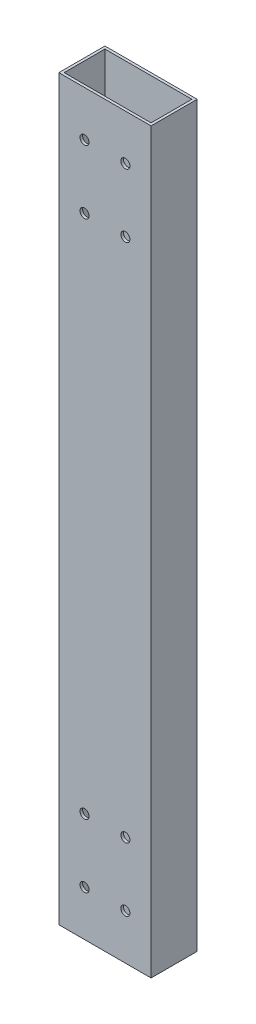
from build123d import *

# Parameters (mm, degrees)
SKETCH1_W           = 50.8
SKETCH1_H           = 25.4
SKETCH1_W_2         = 47.9
SKETCH1_H_2         = 22.5
BOSS_EXTRUDE1_DEPTH = 406.4
SKETCH2_R           = 2.5
CUT_EXTRUDE1_DEPTH  = 408.984411467


with BuildPart() as part:
    # Sketch1 → Boss-Extrude1 (new body)
    with BuildSketch(Plane(origin=(0, 0, 0), x_dir=(1, 0, 0), z_dir=(0, 1, 0))):
        Rectangle(SKETCH1_W, SKETCH1_H)
        Rectangle(SKETCH1_W_2, SKETCH1_H_2, mode=Mode.SUBTRACT)
    extrude(amount=BOSS_EXTRUDE1_DEPTH)

    # Sketch2 → Cut-Extrude1 (cut, through all)
    with BuildSketch(Plane.XY.offset(12.7)):
        with Locations((-11.25, 60)):
            Circle(SKETCH2_R)
        with Locations((-11.25, 25)):
            Circle(SKETCH2_R)
        with Locations((11.25, 25)):
            Circle(SKETCH2_R)
        with Locations((11.25, 60)):
            Circle(SKETCH2_R)
    cut_extrude1 = extrude(amount=-CUT_EXTRUDE1_DEPTH, mode=Mode.SUBTRACT)

    # Mirror1: Cut-Extrude1 across plane
    add(cut_extrude1.mirror(Plane.ZX.offset(203.2)), mode=Mode.SUBTRACT)


solid = part.part
